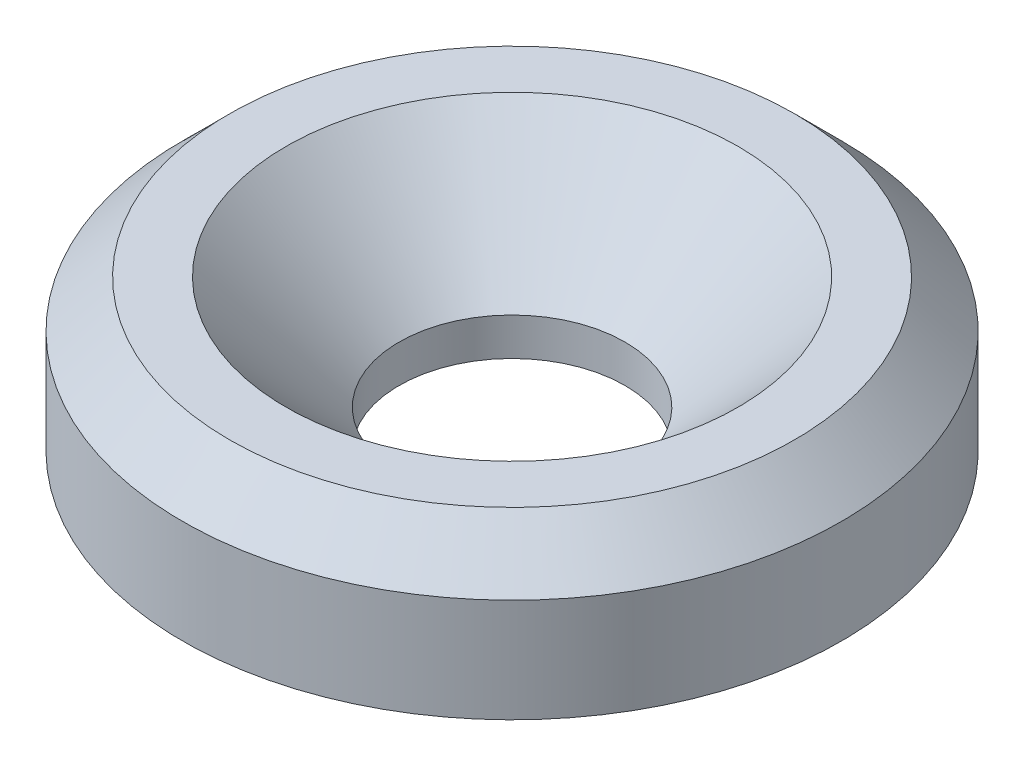
from build123d import *

# Parameters (mm, degrees)
CHAMFER1_SIZE = 2.5


with BuildPart() as part:
    # Sketch1 → Revolve1 (revolve)
    with BuildSketch(Plane.XY, mode=Mode.PRIVATE) as revolve1_sk:
        Polygon((-6, 0), (-6, 2), (-12, 8), (-17.5, 8), (-17.5, 0), align=None)
    revolve(revolve1_sk.sketch.rotate(Axis((0, 0, 0), (0, 1, 0)), 270), axis=Axis((0, 0, 0), (0, 1, 0)))

    # Chamfer1
    chamfer1_edges = [part.edges().sort_by_distance(p)[0] for p in [
        (0, 8, 17.5),
    ]]
    chamfer(chamfer1_edges, length=CHAMFER1_SIZE)


solid = part.part
